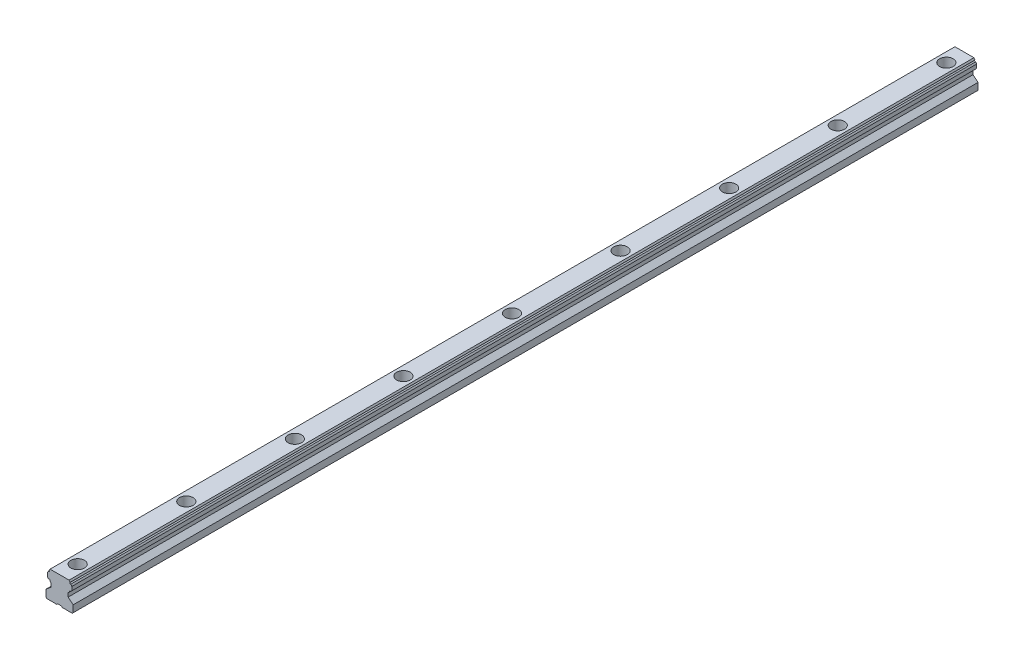
from build123d import *

# Parameters (mm, degrees)
EXTRUDE_2_DEPTH        = 250
SKETCH_4_R             = 2.25
CUT_EXTRUDE_2_DEPTH    = 251.561868607
SKETCH_5_R             = 3.75
CUT_EXTRUDE_3_DEPTH    = 5.3
PATTERN_LINEAR_1_COUNT = 9
PATTERN_LINEAR_1_PITCH = 60


with BuildPart() as part:
    # 草图1 → 凸台-拉伸2 (new, symmetric)
    with BuildSketch(Plane.XY):
        with BuildLine():
            Line((6.75, 8.404656305), (6.205141704, 9.238414341))
            ThreePointArc((6.205141704, 9.238414341), (5.686086188, 9.347186448), (5.794858296, 9.866241964))
            Line((5.794858296, 9.866241964), (5.25, 10.7))
            Line((5.25, 10.7), (-5.25, 10.7))
            Line((-5.25, 10.7), (-5.794858296, 9.866241964))
            ThreePointArc((-5.794858296, 9.866241964), (-5.686086188, 9.347186448), (-6.205141704, 9.238414341))
            Line((-6.205141704, 9.238414341), (-6.75, 8.404656305))
            Line((-6.75, 8.404656305), (-6.75, 6.293987085))
            Line((-6.75, 6.293987085), (-6.023522272, 5.612625848))
            ThreePointArc((-6.023522272, 5.612625848), (-5.493464298, 5.629612418), (-5.476477728, 5.099554443))
            Line((-5.476477728, 5.099554443), (-4.75, 4.418193206))
            Line((-4.75, 4.418193206), (-4.75, 2.307523986))
            Line((-4.75, 2.307523986), (-7.5, 0))
            Line((-7.5, 0), (-7.5, -3.8))
            Line((-7.5, -3.8), (-7, -4.3))
            Line((-7, -4.3), (-1.5, -4.3))
            Line((-1.5, -4.3), (-1, -3.8))
            Line((-1, -3.8), (1, -3.8))
            Line((1, -3.8), (1.5, -4.3))
            Line((1.5, -4.3), (7, -4.3))
            Line((7, -4.3), (7.5, -3.8))
            Line((7.5, -3.8), (7.5, 0))
            Line((7.5, 0), (4.75, 2.307523986))
            Line((4.75, 2.307523986), (4.75, 4.418193206))
            Line((4.75, 4.418193206), (5.476477728, 5.099554443))
            ThreePointArc((5.476477728, 5.099554443), (5.493464298, 5.629612418), (6.023522272, 5.612625848))
            Line((6.023522272, 5.612625848), (6.75, 6.293987085))
            Line((6.75, 6.293987085), (6.75, 8.404656305))
        make_face()
    extrude(amount=EXTRUDE_2_DEPTH, both=True)

    # 草图4 → 切除-拉伸2 (cut, through all)
    with BuildSketch(Plane(origin=(0, 10.7, 0), x_dir=(1, 0, 0), z_dir=(0, 1, 0))):
        with Locations(Location((0, -240, 0), (0, 0, 270))):
            Circle(SKETCH_4_R)
    cut_extrude_2 = extrude(amount=-CUT_EXTRUDE_2_DEPTH, mode=Mode.SUBTRACT)

    # 草图5 → 切除-拉伸3 (cut)
    with BuildSketch(Plane(origin=(0, 10.7, 0), x_dir=(1, 0, 0), z_dir=(0, 1, 0))):
        with Locations(Location((0, -240, 0), (0, 0, 270))):
            Circle(SKETCH_5_R)
    cut_extrude_3 = extrude(amount=-CUT_EXTRUDE_3_DEPTH, mode=Mode.SUBTRACT)

    # 阵列(线性)1: 切除-拉伸2, 切除-拉伸3 ×9
    with Locations(*[(0, 0, -i * PATTERN_LINEAR_1_PITCH) for i in range(1, PATTERN_LINEAR_1_COUNT)]):
        add(cut_extrude_2, mode=Mode.SUBTRACT)
        add(cut_extrude_3, mode=Mode.SUBTRACT)


solid = part.part
